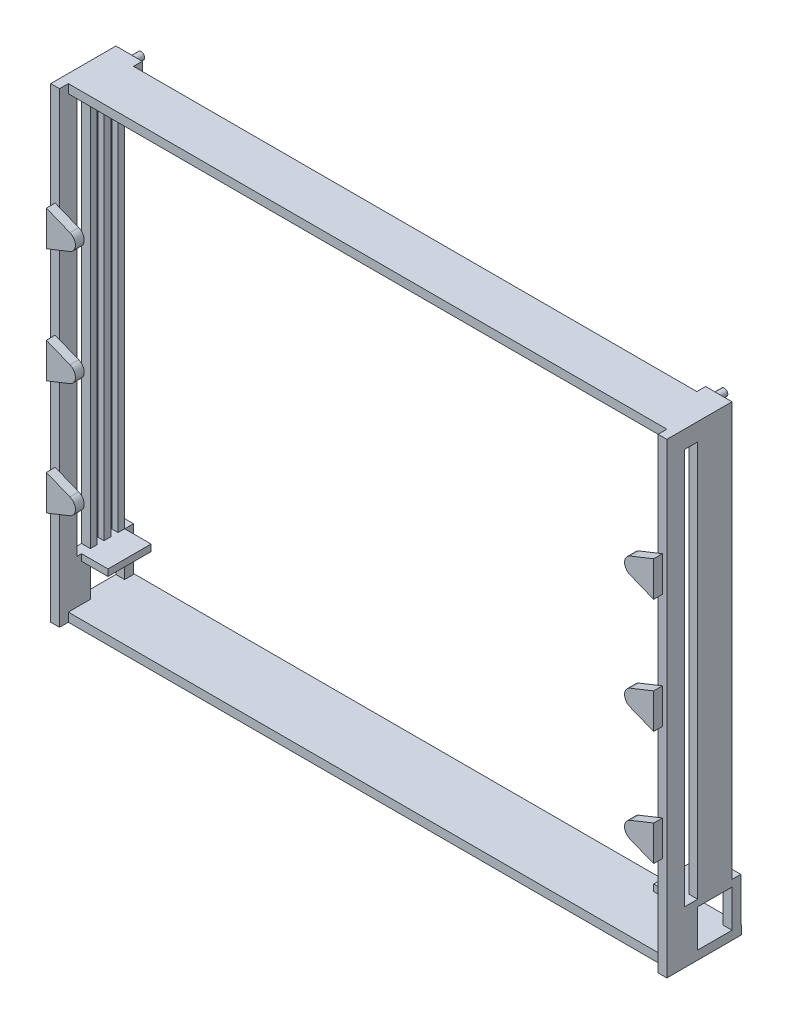
from build123d import *

# Parameters (mm, degrees)
ESQUISSE1_W                  = 10
ESQUISSE1_H                  = 25
BOSS_EXTRU_1_DEPTH           = 530
BOSS_EXTRU_1_2_DEPTH         = 530
BOSS_EXTRU_4_DEPTH           = 10
ESQUISSE8_W                  = 10
ESQUISSE8_H                  = 10
BOSS_EXTRU_5_DEPTH           = 60
ESQUISSE9_W                  = 60
ESQUISSE9_H                  = 10
BOSS_EXTRU_6_DEPTH           = 690
CONG_1_R                     = 10
CONG_2_R                     = 10
CONG_3_R                     = 10
CONG_4_R                     = 10
ESQUISSE10_W                 = 680
ESQUISSE10_H                 = 10
BOSS_EXTRU_7_DEPTH           = 15
ESQUISSE11_W                 = 10
ESQUISSE11_H                 = 50
BOSS_EXTRU_8_DEPTH           = 10
ESQUISSE12_W                 = 10
ESQUISSE12_H                 = 7.5
BOSS_EXTRU_9_DEPTH           = 39
ESQUISSE13_W                 = 49
ESQUISSE13_H                 = 7.5
BOSS_EXTRU_10_DEPTH          = 30
ESQUISSE19_W                 = 49
ESQUISSE19_H                 = 7.5
BOSS_EXTRU_14_DEPTH          = 30
ESQUISSE14_W                 = 10
ESQUISSE14_H                 = 49
BOSS_EXTRU_11_DEPTH          = 470
ESQUISSE16_W                 = 10
ESQUISSE16_H                 = 10
BOSS_EXTRU_12_DEPTH          = 20
ESQUISSE20_W                 = 10
ESQUISSE20_H                 = 10
BOSS_EXTRU_15_DEPTH          = 20
ESQUISSE17_R                 = 4
BOSS_EXTRU_13_DEPTH          = 10
BOSS_EXTRU_16_REACH          = 876.2
ESQUISSE21_W                 = 54
ESQUISSE21_H                 = 10
ENL_V_MAT_EXTRU_1_DEPTH      = 875.199633951
ENL_V_MAT_EXTRU_1_DEPTH_BACK = 875.199633951
ESQUISSE22_W                 = 15
ESQUISSE22_H                 = 450
ESQUISSE23_W                 = 10
ESQUISSE23_H                 = 7.5
BOSS_EXTRU_17_DEPTH          = 10
BOSS_EXTRU_18_REACH          = 853.605
ESQUISSE24_W                 = 10
ESQUISSE24_H                 = 10
ESQUISSE25_W                 = 10
ESQUISSE25_H                 = 7.5
BOSS_EXTRU_19_DEPTH          = 10
BOSS_EXTRU_20_REACH          = 853.605
ESQUISSE26_W                 = 10
ESQUISSE26_H                 = 10
ESQUISSE28_W                 = 8
ESQUISSE28_H                 = 450
ENL_V_MAT_EXTRU_2_DEPTH      = 7
ESQUISSE29_W                 = 8
ESQUISSE29_H                 = 450
ENL_V_MAT_EXTRU_3_DEPTH      = 7


with BuildPart() as part:
    # Esquisse1 → Boss.-Extru.1 (new body)
    with BuildSketch(Plane(origin=(0, 0, 0), x_dir=(1, 0, 0), z_dir=(0, 1, 0))):
        with Locations((5, 12.5)):
            Rectangle(ESQUISSE1_W, ESQUISSE1_H)
    extrude(amount=BOSS_EXTRU_1_DEPTH)

    # Esquisse7 → Boss.-Extru.4 (add)
    with BuildSketch(Plane.XY):
        Polygon((5, 415), (55, 395), (5, 375), align=None)
        Polygon((5, 285), (55, 265), (5, 245), align=None)
        Polygon((5, 155), (55, 135), (5, 115), align=None)
        Polygon((695, 115), (695, 155), (645, 135), align=None)
        Polygon((695, 245), (695, 285), (645, 265), align=None)
        Polygon((695, 375), (695, 415), (645, 395), align=None)
    extrude(amount=BOSS_EXTRU_4_DEPTH)


with BuildPart() as body_2:
    # Esquisse1 → Boss.-Extru.1 2 (new body)
    with BuildSketch(Plane(origin=(0, 0, 0), x_dir=(1, 0, 0), z_dir=(0, 1, 0))):
        with Locations((695, 12.5)):
            Rectangle(ESQUISSE1_W, ESQUISSE1_H)
    extrude(amount=BOSS_EXTRU_1_2_DEPTH)



with BuildPart() as boss_extru_4_piece_1:
    # of the separate pieces the step leaves, piece 1, a body of its own (boss_extru_4_pieces)
    add(part.part.solids().sort_by_distance((0, 0, 0))[0])

    # Esquisse8 → Boss.-Extru.5 (add)
    with BuildSketch(Plane(origin=(0, 0, -25), x_dir=(-1, 0, 0), z_dir=(0, 0, -1))):
        with Locations((-5, 5)):
            Rectangle(ESQUISSE8_W, ESQUISSE8_H)
    extrude(amount=BOSS_EXTRU_5_DEPTH)


with BuildPart() as boss_extru_4_piece_2:
    # of the separate pieces the step leaves, piece 2, a body of its own (boss_extru_4_pieces)
    add(part.part.solids().sort_by_distance((695, 115, 0))[0])

    # Congé4
    cong_4_edges = [boss_extru_4_piece_2.edges().sort_by_distance(p)[0] for p in [
        (645, 135, 5),
    ]]
    fillet(cong_4_edges, radius=CONG_4_R)


with BuildPart() as boss_extru_4_piece_3:
    # of the separate pieces the step leaves, piece 3, a body of its own (boss_extru_4_pieces)
    add(part.part.solids().sort_by_distance((695, 245, 0))[0])

    # Congé3
    cong_3_edges = [boss_extru_4_piece_3.edges().sort_by_distance(p)[0] for p in [
        (645, 265, 5),
    ]]
    fillet(cong_3_edges, radius=CONG_3_R)


with BuildPart() as boss_extru_4_piece_4:
    # of the separate pieces the step leaves, piece 4, a body of its own (boss_extru_4_pieces)
    add(part.part.solids().sort_by_distance((695, 375, 0))[0])

    # Congé2
    cong_2_edges = [boss_extru_4_piece_4.edges().sort_by_distance(p)[0] for p in [
        (645, 395, 5),
    ]]
    fillet(cong_2_edges, radius=CONG_2_R)


with BuildPart() as body_2_1:
    add(body_2.part)

    add(boss_extru_4_piece_1.part)  # Boss.-Extru.6 merges Boss.-Extru.4 piece 1
    # Esquisse9 → Boss.-Extru.6 (add)
    with BuildSketch(Plane(origin=(10, 0, 0), x_dir=(0, 0, -1), z_dir=(1, 0, 0))):
        with Locations((55, 5)):
            Rectangle(ESQUISSE9_W, ESQUISSE9_H)
    extrude(amount=BOSS_EXTRU_6_DEPTH)

    # Congé1
    cong_1_edges = [body_2_1.edges().sort_by_distance(p)[0] for p in [
        (55, 395, 5),
        (55, 265, 5),
        (55, 135, 5),
    ]]
    fillet(cong_1_edges, radius=CONG_1_R)

    # Esquisse10 → Boss.-Extru.7 (add)
    with BuildSketch(Plane.XY.offset(-25)):
        with Locations((350, 5)):
            Rectangle(ESQUISSE10_W, ESQUISSE10_H)
    extrude(amount=BOSS_EXTRU_7_DEPTH)

    # Esquisse11 → Boss.-Extru.8 (add)
    with BuildSketch(Plane(origin=(0, 0, -25), x_dir=(-1, 0, 0), z_dir=(0, 0, -1))):
        with Locations((-695, 35)):
            Rectangle(ESQUISSE11_W, ESQUISSE11_H)
        with Locations((-5, 35)):
            Rectangle(ESQUISSE11_W, ESQUISSE11_H)
    extrude(amount=BOSS_EXTRU_8_DEPTH)

    # Esquisse12 → Boss.-Extru.9 (add)
    with BuildSketch(Plane(origin=(0, 0, -35), x_dir=(-1, 0, 0), z_dir=(0, 0, -1))):
        with Locations((-695, 56.25)):
            Rectangle(ESQUISSE12_W, ESQUISSE12_H)
        with Locations((-5, 56.25)):
            Rectangle(ESQUISSE12_W, ESQUISSE12_H)
    extrude(amount=BOSS_EXTRU_9_DEPTH)

    # Esquisse13 → Boss.-Extru.10 (add)
    with BuildSketch(Plane.ZY.offset(-690)):
        with Locations((-49.5, 56.25)):
            Rectangle(ESQUISSE13_W, ESQUISSE13_H)
    extrude(amount=BOSS_EXTRU_10_DEPTH)

    # Esquisse19 → Boss.-Extru.14 (add)
    with BuildSketch(Plane(origin=(10, 0, 0), x_dir=(0, 0, -1), z_dir=(1, 0, 0))):
        with Locations((49.5, 56.25)):
            Rectangle(ESQUISSE19_W, ESQUISSE19_H)
    extrude(amount=BOSS_EXTRU_14_DEPTH)

    # Esquisse14 → Boss.-Extru.11 (add)
    with BuildSketch(Plane(origin=(0, 60, 0), x_dir=(1, 0, 0), z_dir=(0, 1, 0))):
        with Locations((695, 49.5)):
            Rectangle(ESQUISSE14_W, ESQUISSE14_H)
        with Locations((5, 49.5)):
            Rectangle(ESQUISSE14_W, ESQUISSE14_H)
    extrude(amount=BOSS_EXTRU_11_DEPTH)

    # Esquisse16 → Boss.-Extru.12 (add)
    with BuildSketch(Plane.ZY.offset(-690)):
        with Locations((-69, 525)):
            Rectangle(ESQUISSE16_W, ESQUISSE16_H)
    extrude(amount=BOSS_EXTRU_12_DEPTH)

    # Esquisse20 → Boss.-Extru.15 (add)
    with BuildSketch(Plane(origin=(10, 0, 0), x_dir=(0, 0, -1), z_dir=(1, 0, 0))):
        with Locations((69, 525)):
            Rectangle(ESQUISSE20_W, ESQUISSE20_H)
    extrude(amount=BOSS_EXTRU_15_DEPTH)

    # Esquisse17 → Boss.-Extru.13 (add)
    with BuildSketch(Plane(origin=(0, 0, -74), x_dir=(-1, 0, 0), z_dir=(0, 0, -1))):
        with Locations((-681.25, 525)):
            Circle(ESQUISSE17_R)
        with Locations(Location((-18.75, 525, 0), (0, 0, 180))):
            Circle(ESQUISSE17_R)
    extrude(amount=BOSS_EXTRU_13_DEPTH)

    # Esquisse21 → Boss.-Extru.16 (add, up to next)
    with BuildSketch(Plane(origin=(10, 0, 0), x_dir=(0, 0, -1), z_dir=(1, 0, 0)), mode=Mode.PRIVATE) as boss_extru_16_sk1:
        with Locations((37, 525)):
            Rectangle(ESQUISSE21_W, ESQUISSE21_H)
    boss_extru_16_tool1 = extrude(boss_extru_16_sk1.sketch, amount=BOSS_EXTRU_16_REACH, mode=Mode.PRIVATE) - body_2_1.part
    add(boss_extru_16_tool1.solids().sort_by_distance((10, 525, -37))[0])

    # Esquisse22 → Enlèv. mat.-Extru.1 (cut, two sides: drawn at the far end of the back side and taken through both)
    with BuildSketch(Plane.ZY.offset(-690).offset(-ENL_V_MAT_EXTRU_1_DEPTH_BACK)):
        with Locations((-27.5, 285)):
            Rectangle(ESQUISSE22_W, ESQUISSE22_H)
    extrude(amount=ENL_V_MAT_EXTRU_1_DEPTH + ENL_V_MAT_EXTRU_1_DEPTH_BACK, mode=Mode.SUBTRACT)

    # Esquisse23 → Boss.-Extru.17 (add)
    with BuildSketch(Plane(origin=(0, 0, -74), x_dir=(-1, 0, 0), z_dir=(0, 0, -1))):
        with Locations((-695, 56.25)):
            Rectangle(ESQUISSE23_W, ESQUISSE23_H)
    extrude(amount=BOSS_EXTRU_17_DEPTH)

    # Esquisse24 → Boss.-Extru.18 (add, up to next)
    with BuildSketch(Plane.XZ.offset(-52.5), mode=Mode.PRIVATE) as boss_extru_18_sk1:
        with Locations((695, -79)):
            Rectangle(ESQUISSE24_W, ESQUISSE24_H)
    boss_extru_18_tool1 = extrude(boss_extru_18_sk1.sketch, amount=BOSS_EXTRU_18_REACH, mode=Mode.PRIVATE) - body_2_1.part
    add(boss_extru_18_tool1.solids().sort_by_distance((695, 52.5, -79))[0])

    # Esquisse25 → Boss.-Extru.19 (add)
    with BuildSketch(Plane(origin=(0, 0, -74), x_dir=(-1, 0, 0), z_dir=(0, 0, -1))):
        with Locations((-5, 56.25)):
            Rectangle(ESQUISSE25_W, ESQUISSE25_H)
    extrude(amount=BOSS_EXTRU_19_DEPTH)

    # Esquisse26 → Boss.-Extru.20 (add, up to next)
    with BuildSketch(Plane.XZ.offset(-52.5), mode=Mode.PRIVATE) as boss_extru_20_sk1:
        with Locations((5, -79)):
            Rectangle(ESQUISSE26_W, ESQUISSE26_H)
    boss_extru_20_tool1 = extrude(boss_extru_20_sk1.sketch, amount=BOSS_EXTRU_20_REACH, mode=Mode.PRIVATE) - body_2_1.part
    add(boss_extru_20_tool1.solids().sort_by_distance((5, 52.5, -79))[0])

    # Esquisse28 → Enlèv. mat.-Extru.2 (cut)
    with BuildSketch(Plane.ZY.offset(-690)):
        with Locations((-62.5, 285)):
            Rectangle(ESQUISSE28_W, ESQUISSE28_H)
        with Locations((-46.5, 285)):
            Rectangle(ESQUISSE28_W, ESQUISSE28_H)
    extrude(amount=-ENL_V_MAT_EXTRU_2_DEPTH, mode=Mode.SUBTRACT)

    # Esquisse29 → Enlèv. mat.-Extru.3 (cut)
    with BuildSketch(Plane(origin=(10, 0, 0), x_dir=(0, 0, -1), z_dir=(1, 0, 0))):
        with Locations((46.5, 285)):
            Rectangle(ESQUISSE29_W, ESQUISSE29_H)
        with Locations((62.5, 285)):
            Rectangle(ESQUISSE29_W, ESQUISSE29_H)
    extrude(amount=-ENL_V_MAT_EXTRU_3_DEPTH, mode=Mode.SUBTRACT)


solid = Compound([boss_extru_4_piece_2.part, boss_extru_4_piece_3.part, boss_extru_4_piece_4.part, body_2_1.part])
